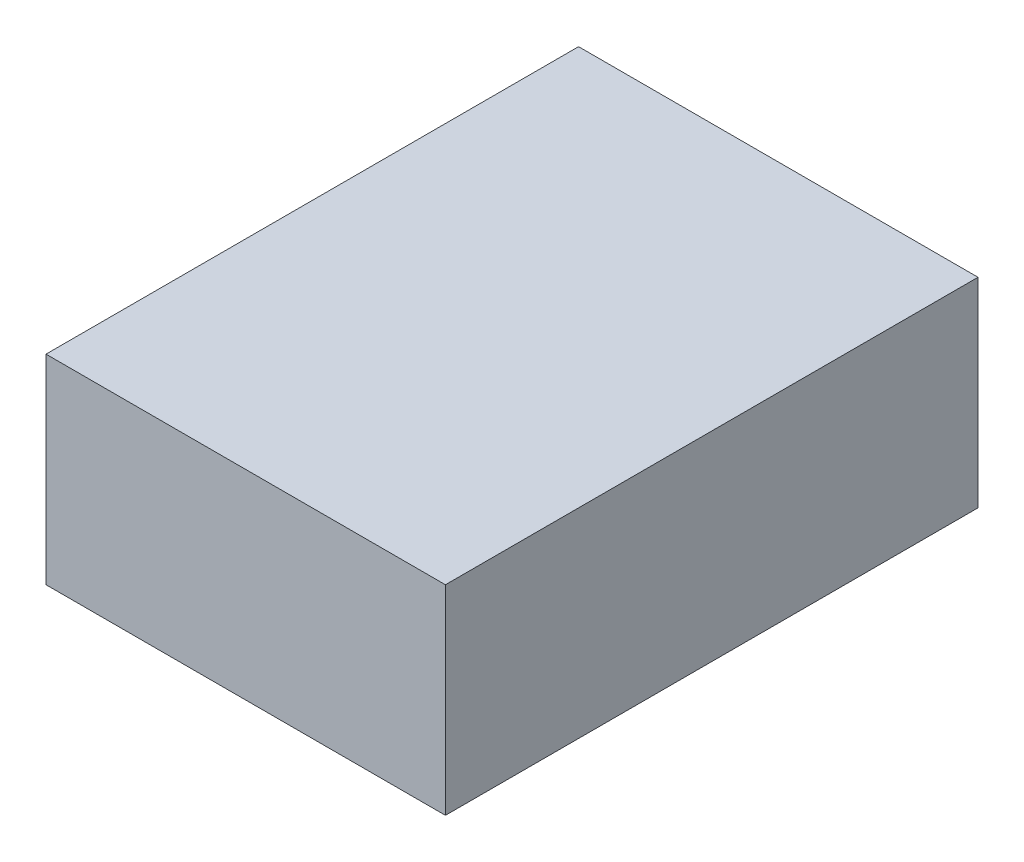
from build123d import *

# Parameters (mm, degrees)
SKETCH1_W           = 30
SKETCH1_H           = 15
BOSS_EXTRUDE1_DEPTH = 40


with BuildPart() as part:
    # Sketch1 → Boss-Extrude1 (new body)
    with BuildSketch(Plane.XY):
        with Locations((-15, 7.5)):
            Rectangle(SKETCH1_W, SKETCH1_H)
    extrude(amount=BOSS_EXTRUDE1_DEPTH)


solid = part.part
